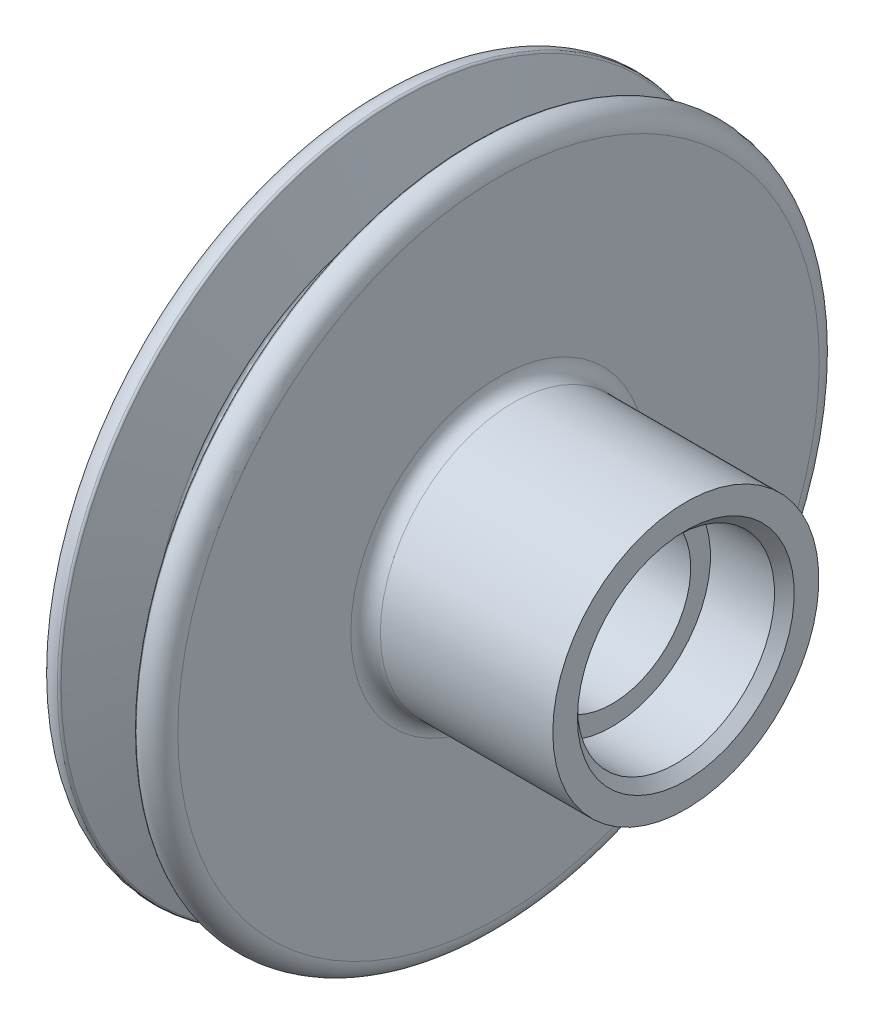
from build123d import *

# Parameters (mm, degrees)
RACCORDO1_R  = 0.5
RACCORDO2_R  = 1
RACCORDO3_R  = 3
SMUSSO1_SIZE = 2


with BuildPart() as part:
    # Schizzo1 → Rivoluzione1 (revolve)
    with BuildSketch(Plane.XY, mode=Mode.PRIVATE) as rivoluzione1_sk:
        with BuildLine():
            Line((4.818481252, 69), (9.404441474, 54))
            Line((9.404441474, 54), (15.595558526, 54))
            Line((15.595558526, 54), (20.181518748, 69))
            ThreePointArc((20.181518748, 69), (23.522506193, 68.188980061), (25, 65.084634316))
            Line((25, 65.084634316), (25, 27))
            Line((25, 27), (63, 27))
            Line((63, 27), (63, 20))
            Line((63, 20), (48, 20))
            Line((48, 20), (48, 16))
            Line((48, 16), (18, 16))
            Line((18, 16), (18, 20))
            Line((18, 20), (0, 20))
            Line((0, 20), (0, 31))
            Line((0, 31), (8, 31))
            ThreePointArc((8, 31), (11, 34), (8, 37))
            Line((8, 37), (0, 37))
            Line((0, 37), (0, 65.084634316))
            ThreePointArc((0, 65.084634316), (1.477493807, 68.188980061), (4.818481252, 69))
        make_face()
    revolve(rivoluzione1_sk.sketch.rotate(Axis((-22.866238166, 0, 0), (1, 0, 0)), 90), axis=Axis((-22.866238166, 0, 0), (1, 0, 0)))

    # Raccordo1
    raccordo1_edges = [part.edges().sort_by_distance(p)[0] for p in [
        (20.181518748, 0, -69),
        (4.818481252, 0, -69),
    ]]
    fillet(raccordo1_edges, radius=RACCORDO1_R)

    # Raccordo2
    raccordo2_edges = [part.edges().sort_by_distance(p)[0] for p in [
        (15.595558526, 0, -54),
        (9.404441474, 0, -54),
    ]]
    fillet(raccordo2_edges, radius=RACCORDO2_R)

    # Raccordo3
    raccordo3_edges = [part.edges().sort_by_distance(p)[0] for p in [
        (25, 0, -27),
    ]]
    fillet(raccordo3_edges, radius=RACCORDO3_R)

    # Smusso1
    smusso1_edges = [part.edges().sort_by_distance(p)[0] for p in [
        (0, 0, -20),
        (63, 0, -20),
    ]]
    chamfer(smusso1_edges, length=SMUSSO1_SIZE)


solid = part.part
